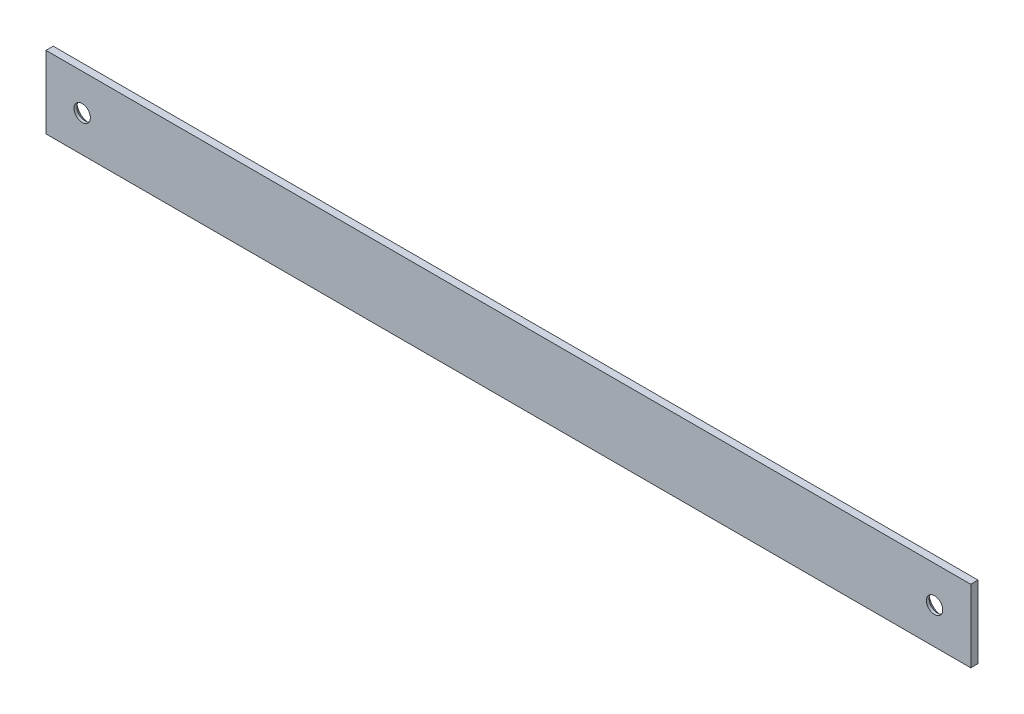
from build123d import *

# Parameters (mm, degrees)
SKETCH3_W                      = 243.3743418
SKETCH3_H                      = 19.05
BOSS_EXTRUDE1_DEPTH            = 1.905
F_6_CLEARANCE_HOLE1_AT_2_COUNT = 2
F_6_CLEARANCE_HOLE1_AT_2_PITCH = 224.3243418


with BuildPart() as part:
    # Sketch3 → Boss-Extrude1 (new body)
    with BuildSketch(Plane.XY):
        Rectangle(SKETCH3_W, SKETCH3_H)
    extrude(amount=BOSS_EXTRUDE1_DEPTH)

    # Sketch5 → #6 Clearance Hole1 (revolve, cut)
    with BuildSketch(Plane.YZ.offset(-112.1621709)):
        Polygon((0, 0), (0, 1.905), (2.15265, 1.905), (2.15265, 1.17475), (3.3274, 0), align=None)
    f_6_clearance_hole1 = revolve(axis=Axis((-112.1621709, 0, -6.35), (0, 0, 1)), mode=Mode.SUBTRACT)

    # #6 Clearance Hole1 at 2: #6 Clearance Hole1 ×2
    with Locations(*[(i * F_6_CLEARANCE_HOLE1_AT_2_PITCH, 0, 0) for i in range(1, F_6_CLEARANCE_HOLE1_AT_2_COUNT)]):
        add(f_6_clearance_hole1, mode=Mode.SUBTRACT)


solid = part.part
